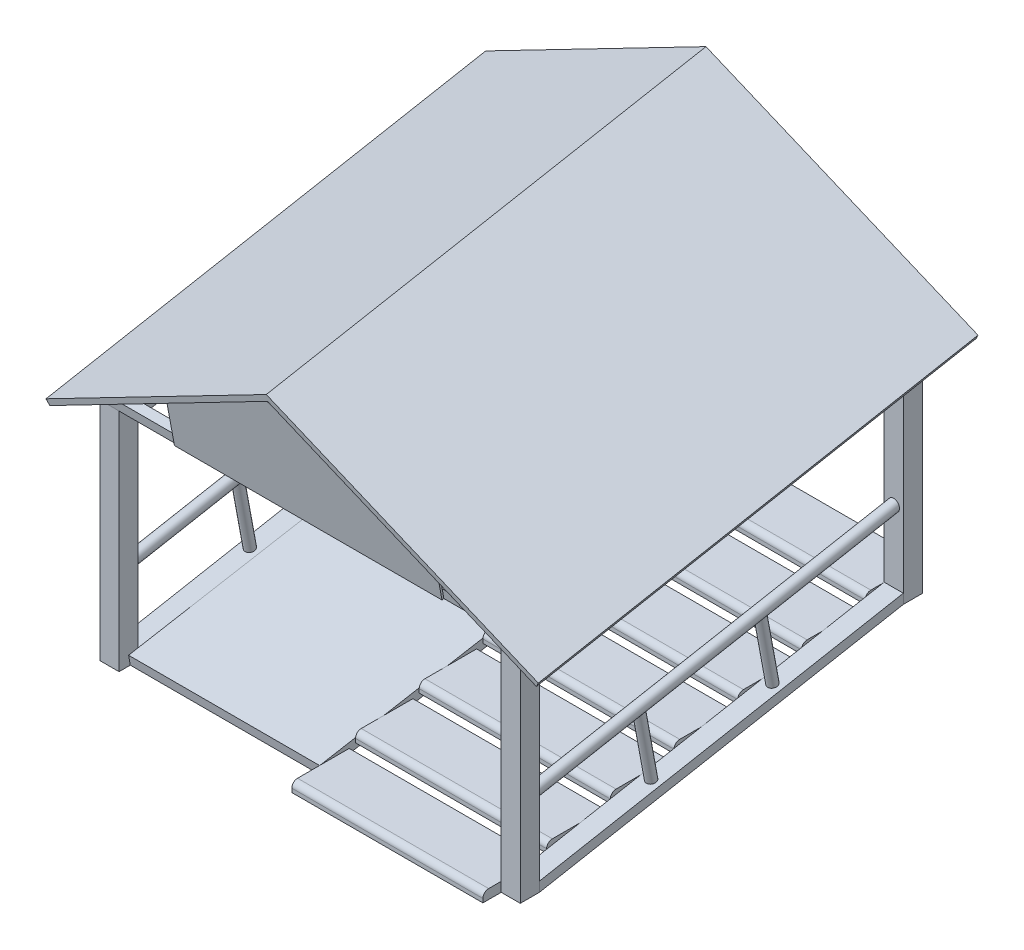
from build123d import *

# Parameters (mm, degrees)
BOSS_EXTRUDE1_DEPTH              = 5000
SKETCH4_W                        = 1500
SKETCH4_H                        = 250
BOSS_EXTRUDE2_DEPTH              = 5000
FILLET1_R                        = 150
LPATTERN6_COUNT                  = 7
LPATTERN6_PITCH                  = 1692.37833333
FILLET2_R                        = 150
FILLET3_R                        = 150
FILLET4_R                        = 150
FILLET5_R                        = 150
FILLET6_R                        = 150
FILLET7_R                        = 150
BOSS_EXTRUDE3_DEPTH              = 500
BOSS_EXTRUDE4_DEPTH              = 500
BOSS_EXTRUDE5_DEPTH              = 500
BOSS_EXTRUDE7_DEPTH              = 250
CUT_EXTRUDE1_DEPTH               = 250
BOSS_EXTRUDE8_DEPTH              = 250
BOSS_EXTRUDE9_DEPTH              = 50
BOSS_EXTRUDE10_DEPTH             = 250
CUT_EXTRUDE2_DEPTH               = 250
BOSS_EXTRUDE11_START             = -250
BOSS_EXTRUDE11_DEPTH             = 50
BOSS_EXTRUDE12_DEPTH             = 10200.600627997
BOSS_EXTRUDE13_DEPTH             = 10700.600627997
BOSS_EXTRUDE14_DEPTH             = 500
BOSS_EXTRUDE15_START             = 10700.600628
BOSS_EXTRUDE15_DEPTH             = 500
BOSS_EXTRUDE16_REACH             = 18836.289
SKETCH17_R                       = 150
BOSS_EXTRUDE16_DIRECTION_2_REACH = 18836.289
BOSS_EXTRUDE17_START             = -500
BOSS_EXTRUDE17_DEPTH             = 500
BOSS_EXTRUDE18_REACH             = 19359.781
BOSS_EXTRUDE18_END_RADIUS        = 150
SKETCH19_R                       = 125
LPATTERN7_COUNT                  = 2
LPATTERN7_PITCH                  = 3227.86666667


with BuildPart() as part:
    # Sketch2 → Boss-Extrude1 (new body)
    with BuildSketch(Plane(origin=(0, 0, 0), x_dir=(0, 0, -1), z_dir=(1, 0, 0))):
        Polygon((0, 0), (10000, 1763.269807085), (10043.412044417, 1517.067868832), (43.412044417, -246.201938253), align=None)
    extrude(amount=BOSS_EXTRUDE1_DEPTH)


with BuildPart() as body_2:
    # Sketch4 → Boss-Extrude2 (new body)
    with BuildSketch(Plane(origin=(5000, 0, 0), x_dir=(0, 0, -1), z_dir=(1, 0, 0))):
        with Locations((21.706022208, -123.100969127)):
            Rectangle(SKETCH4_W, SKETCH4_H)
    boss_extrude2 = extrude(amount=BOSS_EXTRUDE2_DEPTH)

    # Fillet1
    fillet1_edges = [body_2.edges().sort_by_distance(p)[0] for p in [
        (7500, 1.899030873, 728.293977792),
    ]]
    fillet(fillet1_edges, radius=FILLET1_R)


with BuildPart() as lpattern6_1:
    # LPattern6: pattern copy
    add(boss_extrude2.moved(Location(Vector(0, 0.17364817766692373, -0.9848077530122092) * (1 * LPATTERN6_PITCH))))

    # Fillet2
    fillet2_edges = [lpattern6_1.edges().sort_by_distance(p)[0] for p in [
        (7500, 295.777444379, -938.373325902),
    ]]
    fillet(fillet2_edges, radius=FILLET2_R)


with BuildPart() as lpattern6_2:
    # LPattern6: pattern copy
    add(boss_extrude2.moved(Location(Vector(0, 0.17364817766692373, -0.9848077530122092) * (2 * LPATTERN6_PITCH))))

    # Fillet3
    fillet3_edges = [lpattern6_2.edges().sort_by_distance(p)[0] for p in [
        (7500, 589.655857885, -2605.040629595),
    ]]
    fillet(fillet3_edges, radius=FILLET3_R)


with BuildPart() as lpattern6_3:
    # LPattern6: pattern copy
    add(boss_extrude2.moved(Location(Vector(0, 0.17364817766692373, -0.9848077530122092) * (3 * LPATTERN6_PITCH))))

    # Fillet4
    fillet4_edges = [lpattern6_3.edges().sort_by_distance(p)[0] for p in [
        (7500, 883.534271391, -4271.707933288),
    ]]
    fillet(fillet4_edges, radius=FILLET4_R)


with BuildPart() as lpattern6_4:
    # LPattern6: pattern copy
    add(boss_extrude2.moved(Location(Vector(0, 0.17364817766692373, -0.9848077530122092) * (4 * LPATTERN6_PITCH))))

    # Fillet5
    fillet5_edges = [lpattern6_4.edges().sort_by_distance(p)[0] for p in [
        (7500, 1177.412684896, -5938.375236981),
    ]]
    fillet(fillet5_edges, radius=FILLET5_R)


with BuildPart() as lpattern6_5:
    # LPattern6: pattern copy
    add(boss_extrude2.moved(Location(Vector(0, 0.17364817766692373, -0.9848077530122092) * (5 * LPATTERN6_PITCH))))

    # Fillet6
    fillet6_edges = [lpattern6_5.edges().sort_by_distance(p)[0] for p in [
        (7500, 1471.291098402, -7605.042540675),
    ]]
    fillet(fillet6_edges, radius=FILLET6_R)


with BuildPart() as lpattern6_6:
    # LPattern6: pattern copy
    add(boss_extrude2.moved(Location(Vector(0, 0.17364817766692373, -0.9848077530122092) * (6 * LPATTERN6_PITCH))))

    # Fillet7
    fillet7_edges = [lpattern6_6.edges().sort_by_distance(p)[0] for p in [
        (7500, 1765.169511908, -9271.709844368),
    ]]
    fillet(fillet7_edges, radius=FILLET7_R)


with BuildPart() as body_9:
    # Sketch5 → Boss-Extrude3 (new body)
    with BuildSketch(Plane(origin=(10000, 0, 0), x_dir=(0, 0, -1), z_dir=(1, 0, 0))):
        Polygon((-250, -248.100969127), (250, -248.100969127), (250, 5751.899030873), (-250, 5659.306917175), align=None)
    extrude(amount=BOSS_EXTRUDE3_DEPTH)



with BuildPart() as body_10:
    # Sketch5<3> → Boss-Extrude4 (new body)
    with BuildSketch(Plane(origin=(10000, 0, 0), x_dir=(0, 0, -1), z_dir=(1, 0, 0))):
        Polygon((9771.709844368, 1515.169511908), (10271.709844368, 1515.169511908), (10271.709844368, 7515.169511908), (10271.709844368, 7607.761625607), (9771.709844368, 7515.169511908), align=None)
    extrude(amount=BOSS_EXTRUDE4_DEPTH)


with BuildPart() as body_9_1:
    add(body_9.part)

    add(body_10.part)  # Boss-Extrude5 merges body 10
    # Sketch6 → Boss-Extrude5 (add)
    with BuildSketch(Plane(origin=(10500, 0, 0), x_dir=(0, 0, -1), z_dir=(1, 0, 0))):
        Polygon((250, 5751.899030873), (9771.709844368, 7515.169511908), (9771.709844368, 7006.668479933), (250, 5243.397998899), align=None)
    extrude(amount=-BOSS_EXTRUDE5_DEPTH)


with BuildPart() as body_10_2:
    # Mirror1: mirrored copy
    add(body_9_1.part.mirror(Plane(origin=(5000, 0, 0), x_dir=(0, 0, 1), z_dir=(1, 0, 0))))


with BuildPart() as body_11:
    # Sketch7 → Boss-Extrude7 (new body)
    with BuildSketch(Plane(origin=(0, 142.879868604, -771.555280985), x_dir=(-1, 0, 0), z_dir=(0, 0.18208834963285295, -0.9832821736042935))):
        Polygon((500, 5610.217694021), (-10500, 5610.217694021), (-10500, 5860.217694021), (-5000, 9035.644174564), (500, 5860.217694021), align=None)
    extrude(amount=BOSS_EXTRUDE7_DEPTH)

    # Sketch8 → Cut-Extrude1 (cut)
    with BuildSketch(Plane(origin=(0, 142.879868604, -771.555280985), x_dir=(1, 0, 0), z_dir=(0, -0.1820883496328534, 0.9832821736042934))):
        Polygon((5000, 8746.96903997), (0, 5860.217694021), (10000, 5860.217694021), align=None)
    extrude(amount=-CUT_EXTRUDE1_DEPTH, mode=Mode.SUBTRACT)


with BuildPart() as body_12:
    # Sketch10 → Boss-Extrude8 (new body)
    with BuildSketch(Plane(origin=(0, 142.879868604, -771.555280985), x_dir=(1, 0, 0), z_dir=(0, -0.1820883496328534, 0.9832821736042934))):
        Polygon((4875, 8674.800256321), (4875, 5860.217694021), (5125, 5860.217694021), (5125, 8674.800256321), (5000, 8746.96903997), align=None)
    extrude(amount=-BOSS_EXTRUDE8_DEPTH)


with BuildPart() as body_13:
    # Sketch11 → Boss-Extrude9 (new body)
    with BuildSketch(Plane(origin=(0, 142.879868604, -771.555280985), x_dir=(1, 0, 0), z_dir=(0, -0.1820883496328534, 0.9832821736042934))):
        Polygon((1500, 7014.918232401), (1500, 5610.217694021), (8500, 5610.217694021), (8500, 7014.918232401), (6169.872981078, 8360.217694021), (3830.127018922, 8360.217694021), align=None)
    extrude(amount=BOSS_EXTRUDE9_DEPTH)

    # Combine1: union body 12, body 11
    add(body_12.part)
    add(body_11.part)


with BuildPart() as body_12_2:
    # Sketch12 → Boss-Extrude10 (new body)
    with BuildSketch(Plane(origin=(0, 2091.334577036, -11293.265125353), x_dir=(-1, 0, 0), z_dir=(0, 0.1820883496328534, -0.9832821736042934))):
        Polygon((500, 5610.217694021), (500, 5860.217694021), (-5000, 9035.644174564), (-10500, 5860.217694021), (-10500, 5610.217694021), align=None)
    extrude(amount=-BOSS_EXTRUDE10_DEPTH)

    # Sketch13 → Cut-Extrude2 (cut)
    with BuildSketch(Plane(origin=(0, 2091.334577036, -11293.265125353), x_dir=(-1, 0, 0), z_dir=(0, 0.1820883496328534, -0.9832821736042934))):
        Polygon((-4875, 8674.800256321), (0, 5860.217694021), (-4875, 5860.217694021), align=None)
        Polygon((-5125, 5860.217694021), (-10000, 5860.217694021), (-5125, 8674.800256321), align=None)
    extrude(amount=-CUT_EXTRUDE2_DEPTH, mode=Mode.SUBTRACT)


with BuildPart() as body_13_2:
    # Sketch14 → Boss-Extrude11 (new body)
    with BuildSketch(Plane(origin=(0, 2091.334577036, -11293.265125353), x_dir=(-1, 0, 0), z_dir=(0, 0.1820883496328534, -0.9832821736042934)).offset(BOSS_EXTRUDE11_START)):
        Polygon((-1500, 7014.918232401), (-3830.127018922, 8360.217694021), (-6169.872981078, 8360.217694021), (-8500, 7014.918232401), (-8500, 5610.217694021), (-1500, 5610.217694021), align=None)
    extrude(amount=-BOSS_EXTRUDE11_DEPTH)


with BuildPart() as body_14:
    # Sketch15 → Boss-Extrude12 (new body)
    with BuildSketch(Plane(origin=(0, 188.401956012, -1017.375824386), x_dir=(-1, 0, 0), z_dir=(0, 0.1820883496328534, -0.9832821736042934))):
        Polygon((-5125, 8674.800256321), (-5125, 8963.475390916), (-5000, 9035.644174564), (-4875, 8963.475390916), (-4875, 8674.800256321), align=None)
    extrude(amount=BOSS_EXTRUDE12_DEPTH)


with BuildPart() as body_15:
    # Sketch16 → Boss-Extrude13 (new body)
    with BuildSketch(Plane(origin=(0, 142.879868604, -771.555280985), x_dir=(-1, 0, 0), z_dir=(0, 0.18208834963285295, -0.9832821736042935))):
        Polygon((500, 5860.217694021), (-5000, 9035.644174564), (-10500, 5860.217694021), (-11366.025403784, 5360.217694021), (-11441.025403784, 5490.121504589), (-5000, 9208.849255321), (1441.025403784, 5490.121504589), (1366.025403784, 5360.217694021), align=None)
    extrude(amount=BOSS_EXTRUDE13_DEPTH)

    # Sketch16<3> → Boss-Extrude14 (add)
    with BuildSketch(Plane(origin=(0, 142.879868604, -771.555280985), x_dir=(-1, 0, 0), z_dir=(0, 0.18208834963285295, -0.9832821736042935))):
        Polygon((500, 5860.217694021), (-5000, 9035.644174564), (-10500, 5860.217694021), (-11366.025403784, 5360.217694021), (-11441.025403784, 5490.121504589), (-5000, 9208.849255321), (1441.025403784, 5490.121504589), (1366.025403784, 5360.217694021), align=None)
    extrude(amount=-BOSS_EXTRUDE14_DEPTH)

    # Sketch16<4> → Boss-Extrude15 (add)
    with BuildSketch(Plane(origin=(0, 142.879868604, -771.555280985), x_dir=(-1, 0, 0), z_dir=(0, 0.18208834963285295, -0.9832821736042935)).offset(BOSS_EXTRUDE15_START)):
        Polygon((500, 5860.217694021), (-5000, 9035.644174564), (-10500, 5860.217694021), (-11366.025403784, 5360.217694021), (-11441.025403784, 5490.121504589), (-5000, 9208.849255321), (1441.025403784, 5490.121504589), (1366.025403784, 5360.217694021), align=None)
    extrude(amount=BOSS_EXTRUDE15_DEPTH)


with BuildPart() as body_16:
    # Boss-Extrude16: up to this plane
    boss_extrude16_end = Plane(origin=(10500, 1515.169511908, -9771.709844368), z_dir=(0, 0, 1))
    # Sketch17 → Boss-Extrude16 (new, up to the surface)
    with BuildSketch(Plane(origin=(0, 142.879868604, -771.555280985), x_dir=(-1, 0, 0), z_dir=(0, 0.18208834963285295, -0.9832821736042935)), mode=Mode.PRIVATE) as boss_extrude16_sk1:
        with Locations(Location((-10250, 1801.568827212, 0), (0, 0, 270))):
            Circle(SKETCH17_R)
    boss_extrude16_tool1 = split(extrude(boss_extrude16_sk1.sketch, amount=BOSS_EXTRUDE16_REACH, mode=Mode.PRIVATE), bisect_by=boss_extrude16_end, keep=Keep.BOTH, mode=Mode.PRIVATE)
    add(boss_extrude16_tool1.solids().sort_by_distance((10250, 1914.330381, -443.510586))[0])

    # Boss-Extrude16 direction 2: up to this plane
    boss_extrude16_direction_2_end = Plane(origin=(10500, -248.100969127, -250), z_dir=(0, 0, 1))
    # Sketch17 → Boss-Extrude16 direction 2 (add, up to the surface)
    with BuildSketch(Plane(origin=(0, 142.879868604, -771.555280985), x_dir=(-1, 0, 0), z_dir=(0, 0.18208834963285295, -0.9832821736042935)), mode=Mode.PRIVATE) as boss_extrude16_direction_2_sk1:
        with Locations(Location((-10250, 1801.568827212, 0), (0, 0, 270))):
            Circle(SKETCH17_R)
    boss_extrude16_direction_2_tool1 = split(extrude(boss_extrude16_direction_2_sk1.sketch, amount=-BOSS_EXTRUDE16_DIRECTION_2_REACH, mode=Mode.PRIVATE), bisect_by=boss_extrude16_direction_2_end, keep=Keep.BOTH, mode=Mode.PRIVATE)
    add(boss_extrude16_direction_2_tool1.solids().sort_by_distance((10250, 1914.330381, -443.510586))[0])


with BuildPart() as body_17:
    # Sketch18 → Boss-Extrude17 (new body)
    with BuildSketch(Plane(origin=(10500, 0, 0), x_dir=(0, 0, -1), z_dir=(1, 0, 0)).offset(BOSS_EXTRUDE17_START)):
        Polygon((250, -248.100969127), (9771.709844368, 1515.169511908), (9771.709844368, 1769.420027895), (250, 6.149546861), align=None)
    extrude(amount=BOSS_EXTRUDE17_DEPTH)


with BuildPart() as body_18:
    # Boss-Extrude18: up to this cylinder (the profile starts outside it)
    boss_extrude18_end = Plane(origin=(10250, 2404.172378924, -3088.671056605), z_dir=(0, -0.18208834963285295, 0.9832821736042935)) * Cylinder(BOSS_EXTRUDE18_END_RADIUS, 39020.562, mode=Mode.PRIVATE)
    # Sketch19 → Boss-Extrude18 (new, up to the surface)
    with BuildSketch(Plane(origin=(0, -38.815405596, -7.188000896), x_dir=(1, 0, 0), z_dir=(0, 0.9832821736042939, 0.18208834963285134)), mode=Mode.PRIVATE) as boss_extrude18_sk1:
        with Locations(Location((10250, 3474.80697091, 0), (0, 0, 90))):
            Circle(SKETCH19_R)
    boss_extrude18_tool1 = extrude(boss_extrude18_sk1.sketch, amount=BOSS_EXTRUDE18_REACH, mode=Mode.PRIVATE) - boss_extrude18_end
    add(boss_extrude18_tool1.solids().sort_by_distance((10250, 593.906461, -3423.903752))[0])


with BuildPart() as lpattern7_1:
    # LPattern7: pattern copy
    add(body_18.part.moved(Location(Vector(0, 0.18208834963285137, -0.9832821736042938) * (1 * LPATTERN7_PITCH))))


with BuildPart() as body_16_1:
    add(body_16.part)

    # Combine2: union body 18, LPattern7_1
    add(body_18.part)
    add(lpattern7_1.part)


with BuildPart() as body_18_2:
    # Mirror4: mirrored copy
    add(body_16_1.part.mirror(Plane(origin=(5000, 0, 0), x_dir=(0, 0, 1), z_dir=(1, 0, 0))))


with BuildPart() as body_19:
    # Mirror4 2: mirrored copy
    add(body_17.part.mirror(Plane(origin=(5000, 0, 0), x_dir=(0, 0, 1), z_dir=(1, 0, 0))))


solid = Compound([part.part, body_2.part, lpattern6_1.part, lpattern6_2.part, lpattern6_3.part, lpattern6_4.part, lpattern6_5.part, lpattern6_6.part, body_9_1.part, body_10_2.part, body_13.part, body_12_2.part, body_13_2.part, body_14.part, body_15.part, body_17.part, body_16_1.part, body_18_2.part, body_19.part])
